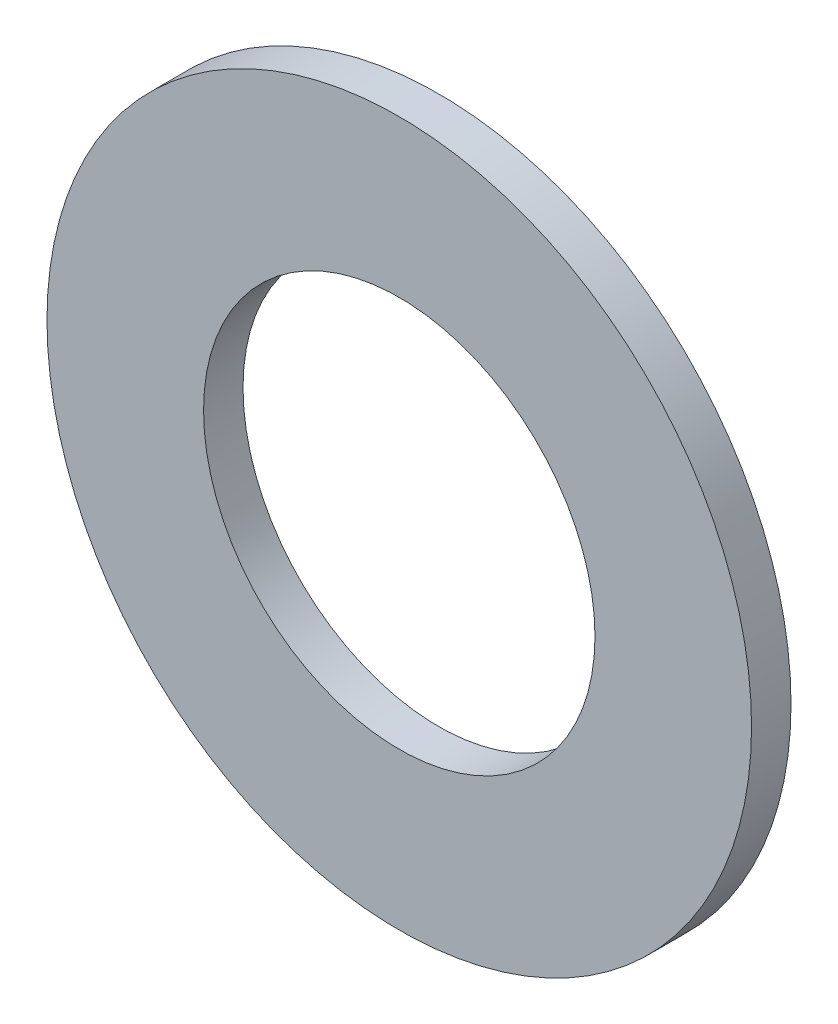
from build123d import *

# Parameters (mm, degrees)
BOSS_EXTRUDE1_DEPTH      = 0.8001
BOSS_EXTRUDE1_DEPTH_BACK = 0.8001
SKETCH3_R                = 14.2875
SKETCH3_R_2              = 7.9375


with BuildPart() as part:
    # Sketch3 → Boss-Extrude1 (new, two sides: drawn at the far end of the back side and taken through both)
    with BuildSketch(Plane.XY.offset(-BOSS_EXTRUDE1_DEPTH_BACK)):
        Circle(SKETCH3_R)
        Circle(SKETCH3_R_2, mode=Mode.SUBTRACT)
    extrude(amount=BOSS_EXTRUDE1_DEPTH + BOSS_EXTRUDE1_DEPTH_BACK)


solid = part.part
